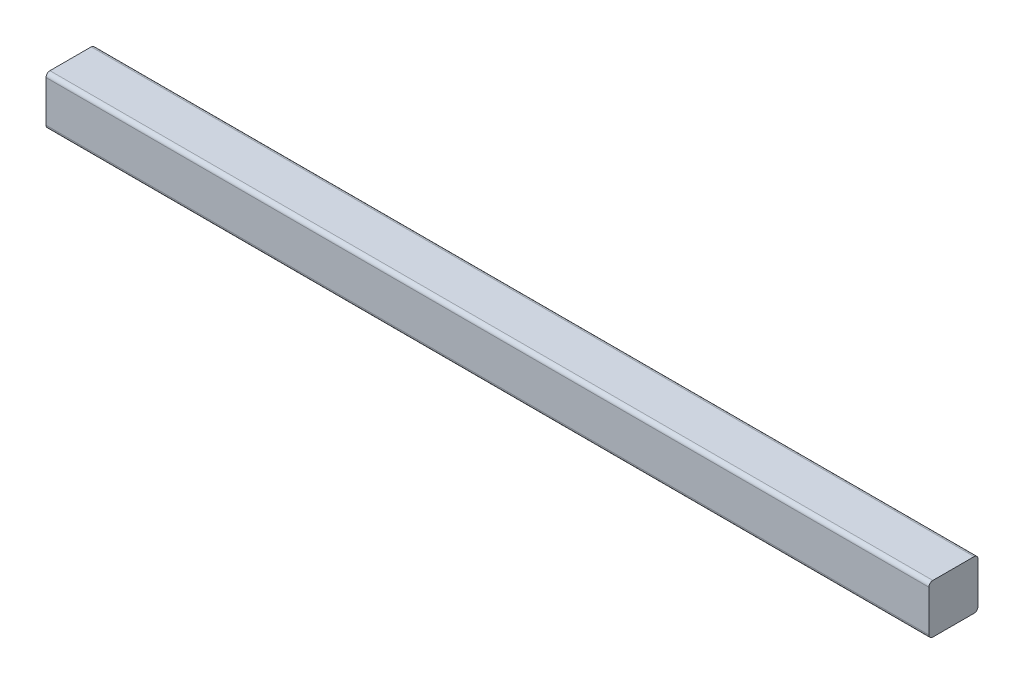
from build123d import *

# Parameters (mm, degrees)
SKETCH1_W           = 57.091934932
SKETCH1_H           = 3.175
BOSS_EXTRUDE1_DEPTH = 1.5875
FILLET1_R           = 0.254


with BuildPart() as part:
    # Sketch1 → Boss-Extrude1 (new, symmetric)
    with BuildSketch(Plane.XY):
        with Locations((16.893041934, 0)):
            Rectangle(SKETCH1_W, SKETCH1_H)
    extrude(amount=BOSS_EXTRUDE1_DEPTH, both=True)

    # Fillet1
    fillet1_edges = [part.edges().sort_by_distance(p)[0] for p in [
        (16.893041934, -1.5875, 1.5875),
        (16.893041934, -1.5875, -1.5875),
        (16.893041934, 1.5875, -1.5875),
        (16.893041934, 1.5875, 1.5875),
    ]]
    fillet(fillet1_edges, radius=FILLET1_R)


solid = part.part
